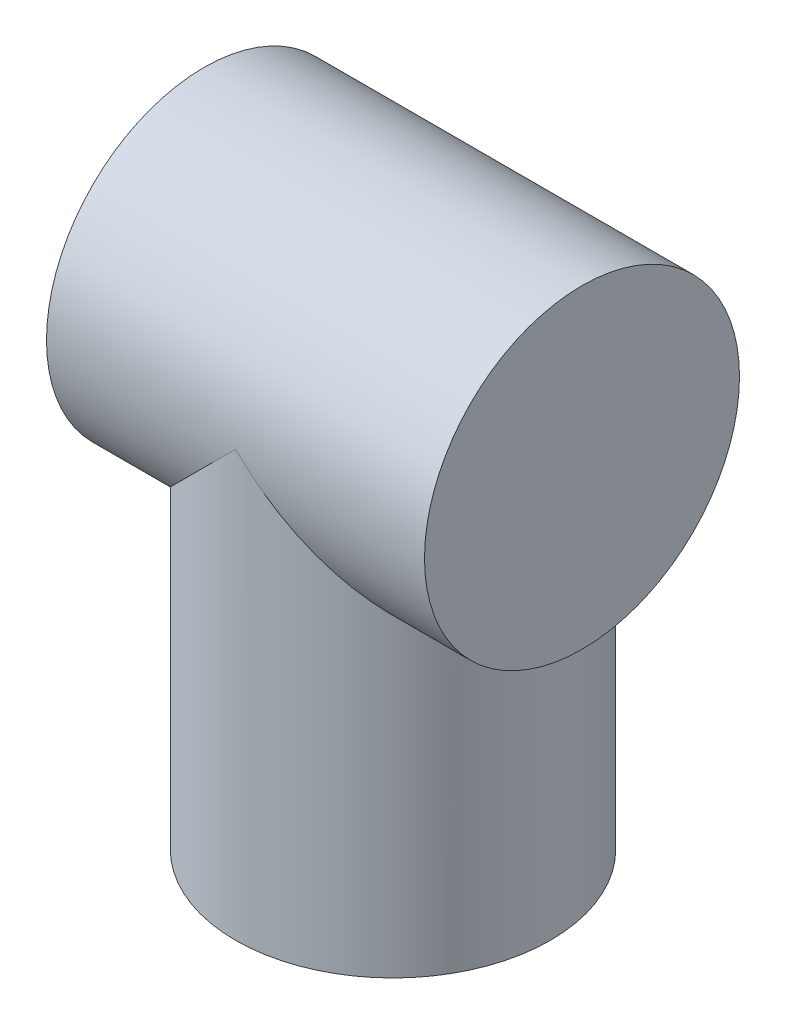
from build123d import *

# Parameters (mm, degrees)
SKETCH_1_R      = 50
EXTRUDE_1_DEPTH = 135
SKETCH_2_R      = 50
EXTRUDE_2_DEPTH = 60


with BuildPart() as part:
    # 草图1 → 凸台-拉伸1 (new body)
    with BuildSketch(Plane(origin=(0, 0, 0), x_dir=(1, 0, 0), z_dir=(0, 1, 0))):
        with Locations(Location((0, 0, 0), (0, 0, 270))):
            Circle(SKETCH_1_R)
    extrude(amount=EXTRUDE_1_DEPTH)

    # 草图2 → 凸台-拉伸2 (add, symmetric)
    with BuildSketch(Plane(origin=(0, 0, 0), x_dir=(0, 0, -1), z_dir=(1, 0, 0))):
        with Locations((0, 135)):
            Circle(SKETCH_2_R)
    extrude(amount=EXTRUDE_2_DEPTH, both=True)


solid = part.part
